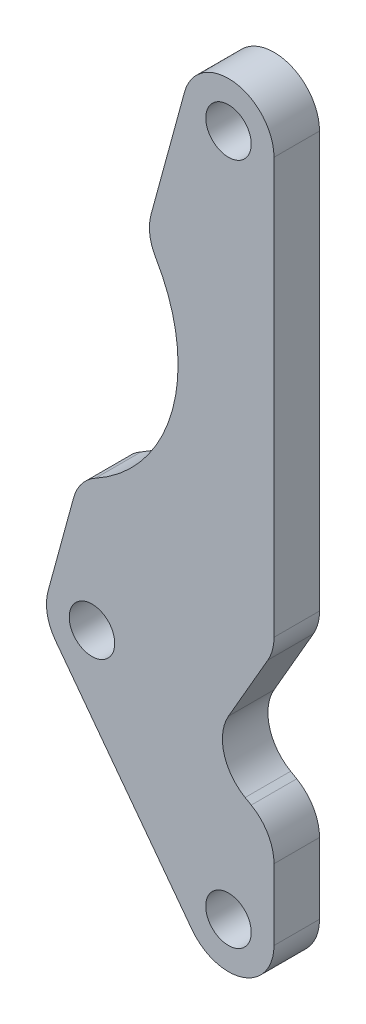
from build123d import *

# Parameters (mm, degrees)
SKETCH1_R           = 5
SKETCH1_R_2         = 2.5
BOSS_EXTRUDE1_DEPTH = 5
CUT_EXTRUDE2_DEPTH  = 5
FILLET1_R           = 5
CUT_EXTRUDE3_DEPTH  = 69.190908485
FILLET2_R           = 5


with BuildPart() as part:
    # Sketch1 → Boss-Extrude1 (new body)
    # profile 1 of 4: a face of its own
    with BuildSketch(Plane.XY):
        with BuildLine():
            Line((5, -15), (5, 60))
            ThreePointArc((5, 60), (-0.663665755, 55.04424095), (-4.823819106, 61.315587029))
            Line((-4.823819106, 61.315587029), (-19.823819106, 6.315587029))
            ThreePointArc((-19.823819106, 6.315587029), (-14.336334245, 9.95575905), (-10, 5))
            ThreePointArc((-10, 5), (-13.41886117, 0.25658351), (-19, 2))
            Line((-19, 2), (-4, -18))
            ThreePointArc((-4, -18), (-1.58113883, -10.25658351), (5, -15))
        make_face()
    # profile 2 of 4: a face of its own
    with BuildSketch(Plane.XY):
        with Locations((-15, 5)):
            Circle(SKETCH1_R)
        with Locations((-15, 5)):
            Circle(SKETCH1_R_2, mode=Mode.SUBTRACT)
    # profile 3 of 4: a face of its own
    with BuildSketch(Plane.XY):
        with Locations((0, -15)):
            Circle(SKETCH1_R)
        with Locations((0, -15)):
            Circle(SKETCH1_R_2, mode=Mode.SUBTRACT)
    # profile 4 of 4: a face of its own
    with BuildSketch(Plane.XY):
        with Locations((0, 60)):
            Circle(SKETCH1_R)
        with Locations((0, 60)):
            Circle(SKETCH1_R_2, mode=Mode.SUBTRACT)
    extrude(amount=BOSS_EXTRUDE1_DEPTH)

    # Sketch3 → Cut-Extrude2 (cut)
    with BuildSketch(Plane.XY.offset(5)):
        Polygon((5, 12.990381057), (5, -4.330127019), (-2.5, 0), align=None)
    extrude(amount=-CUT_EXTRUDE2_DEPTH, mode=Mode.SUBTRACT)

    # Fillet1
    fillet1_edges = [part.edges().sort_by_distance(p)[0] for p in [
        (-2.5, 0, 2.5),
        (5, 12.990381057, 2.5),
        (5, -4.330127019, 2.5),
    ]]
    fillet(fillet1_edges, radius=FILLET1_R)

    # Sketch4 → Cut-Extrude3 (cut, through all)
    with BuildSketch(Plane.XY.offset(5)):
        with BuildLine():
            Line((-9.110982773, 45.595986917), (-16.418905931, 18.800268672))
            ThreePointArc((-16.418905931, 18.800268672), (-6.155108901, 30.395445399), (-9.110982773, 45.595986917))
        make_face()
    extrude(amount=-CUT_EXTRUDE3_DEPTH, mode=Mode.SUBTRACT)

    # Fillet2
    fillet2_edges = [part.edges().sort_by_distance(p)[0] for p in [
        (-9.110982773, 45.595986917, 2.5),
        (-16.418905931, 18.800268672, 2.5),
    ]]
    fillet(fillet2_edges, radius=FILLET2_R)


solid = part.part
